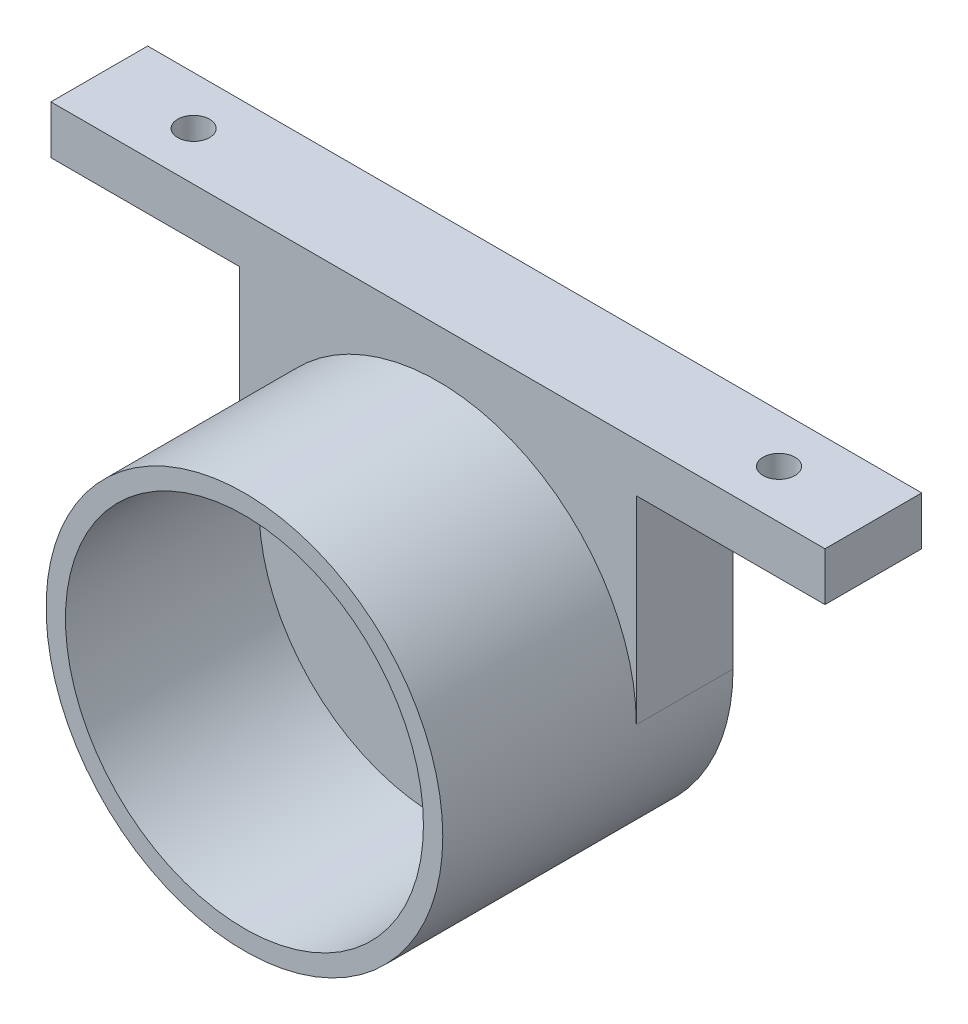
from build123d import *

# Parameters (mm, degrees)
ESQUISSE1_R                 = 20.5
ESQUISSE1_R_2               = 18.5
BOSS_EXTRU_1_DEPTH          = 20
BOSS_EXTRU_2_START          = 10
ESQUISSE2_R                 = 20.5
BOSS_EXTRU_2_DEPTH          = 10
BOSS_EXTRU_4_DEPTH          = 5
BOSS_EXTRU_5_DEPTH          = 10
TROU_TARAUD_M41_D           = 3.3
TROU_TARAUD_M41_CSINK_D     = 4.05
TROU_TARAUD_M41_CSINK_ANGLE = 90


with BuildPart() as part:
    # Esquisse1 → Boss.-Extru.1 (new body)
    with BuildSketch(Plane.XY):
        Circle(ESQUISSE1_R)
        Circle(ESQUISSE1_R_2, mode=Mode.SUBTRACT)
    extrude(amount=BOSS_EXTRU_1_DEPTH)

    # Esquisse2 → Boss.-Extru.2 (add)
    with BuildSketch(Plane(origin=(0, 0, 0), x_dir=(-1, 0, 0), z_dir=(0, 0, -1)).offset(BOSS_EXTRU_2_START)):
        Circle(ESQUISSE2_R)
    extrude(amount=-BOSS_EXTRU_2_DEPTH)



with BuildPart() as body_2:
    # Esquisse5 → Boss.-Extru.4 (new body)
    with BuildSketch(Plane(origin=(0, 20.5, 0), x_dir=(1, 0, 0), z_dir=(0, 1, 0))):
        Polygon((0, 0), (40, 0), (40, 10), (10, 10), (-40, 10), (-40, 0), align=None)
    extrude(amount=BOSS_EXTRU_4_DEPTH)


with BuildPart() as part_1:
    add(part.part)

    add(body_2.part)  # Boss.-Extru.5 merges body 2
    # Esquisse7 → Boss.-Extru.5 (add)
    with BuildSketch(Plane.XY.offset(-10)):
        with BuildLine():
            ThreePointArc((20.5, 0), (14.495689014, 14.495689014), (0, 20.5))
            Line((0, 20.5), (20.5, 20.5))
            Line((20.5, 20.5), (20.5, 0))
        make_face()
        with BuildLine():
            Line((-20.5, 20.5), (-20.5, 0))
            ThreePointArc((-20.5, 0), (-14.495689014, 14.495689014), (0, 20.5))
            Line((0, 20.5), (-20.5, 20.5))
        make_face()
    extrude(amount=BOSS_EXTRU_5_DEPTH)

    # Trou taraudé M41 (through all)
    with Locations(Plane(origin=(0, 20.5, 0), x_dir=(-1, 0, 0), z_dir=(0, -1, 0))):
        with Locations((-30.25, 5), (30.25, 5)):
            CounterSinkHole(TROU_TARAUD_M41_D / 2, TROU_TARAUD_M41_CSINK_D / 2, counter_sink_angle=TROU_TARAUD_M41_CSINK_ANGLE)


solid = part_1.part
